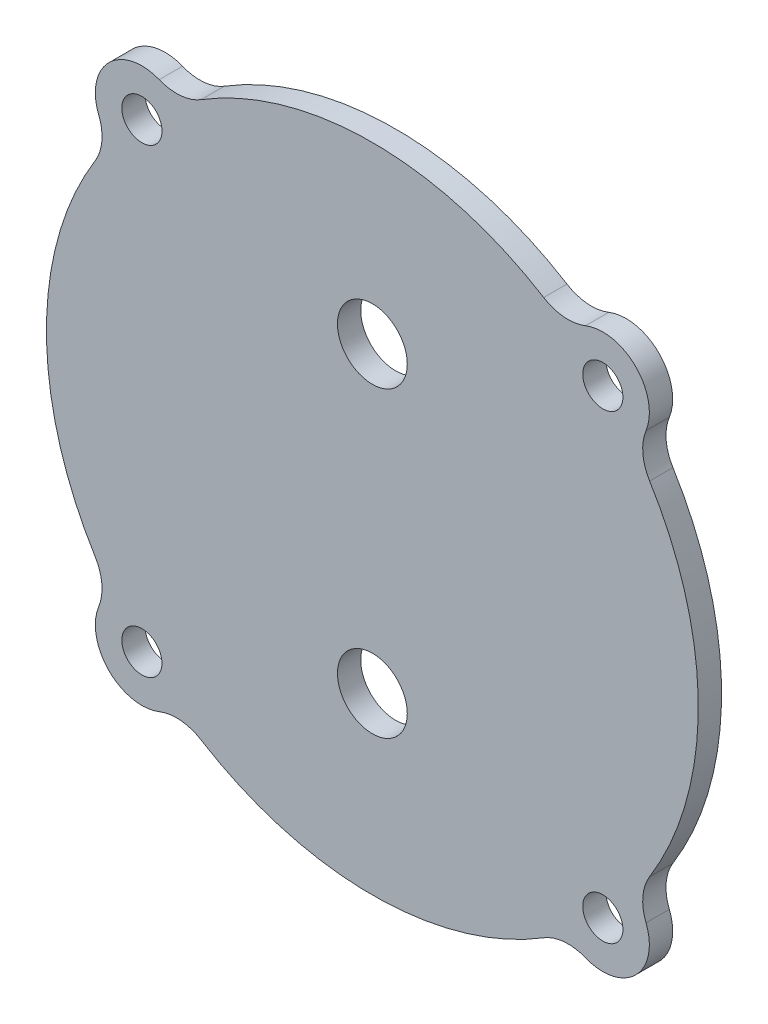
from build123d import *

# Parameters (mm, degrees)
SKETCH1_R           = 1.725
SKETCH1_R_2         = 3
BOSS_EXTRUDE1_DEPTH = 2
FILLET1_R           = 4


with BuildPart() as part:
    # Sketch1 → Boss-Extrude1 (new body)
    with BuildSketch(Plane.XY):
        with BuildLine():
            ThreePointArc((16.775756842, 22.418161887), (0, 28), (-16.775756842, 22.418161887))
            ThreePointArc((-16.775756842, 22.418161887), (-22.627416998, 22.627416998), (-22.418161887, 16.775756842))
            ThreePointArc((-22.418161887, 16.775756842), (-28, 0), (-22.418161887, -16.775756842))
            ThreePointArc((-22.418161887, -16.775756842), (-22.627416998, -22.627416998), (-16.775756842, -22.418161887))
            ThreePointArc((-16.775756842, -22.418161887), (0, -28), (16.775756842, -22.418161887))
            ThreePointArc((16.775756842, -22.418161887), (22.627416998, -22.627416998), (22.418161887, -16.775756842))
            ThreePointArc((22.418161887, -16.775756842), (28, 0), (22.418161887, 16.775756842))
            ThreePointArc((22.418161887, 16.775756842), (22.627416998, 22.627416998), (16.775756842, 22.418161887))
        make_face()
        with Locations((19.798989873, 19.798989873)):
            Circle(SKETCH1_R, mode=Mode.SUBTRACT)
        with Locations((-19.798989873, 19.798989873)):
            Circle(SKETCH1_R, mode=Mode.SUBTRACT)
        with Locations((-19.798989873, -19.798989873)):
            Circle(SKETCH1_R, mode=Mode.SUBTRACT)
        with Locations((19.798989873, -19.798989873)):
            Circle(SKETCH1_R, mode=Mode.SUBTRACT)
        with Locations((0, 13)):
            Circle(SKETCH1_R_2, mode=Mode.SUBTRACT)
        with Locations((0, -13)):
            Circle(SKETCH1_R_2, mode=Mode.SUBTRACT)
    extrude(amount=BOSS_EXTRUDE1_DEPTH)

    # Fillet1
    fillet1_edges = [part.edges().sort_by_distance(p)[0] for p in [
        (16.775756842, 22.418161887, 1),
        (22.418161887, 16.775756842, 1),
        (22.418161887, -16.775756842, 1),
        (16.775756842, -22.418161887, 1),
        (-16.775756842, -22.418161887, 1),
        (-22.418161887, -16.775756842, 1),
        (-22.418161887, 16.775756842, 1),
        (-16.775756842, 22.418161887, 1),
    ]]
    fillet(fillet1_edges, radius=FILLET1_R)


solid = part.part
